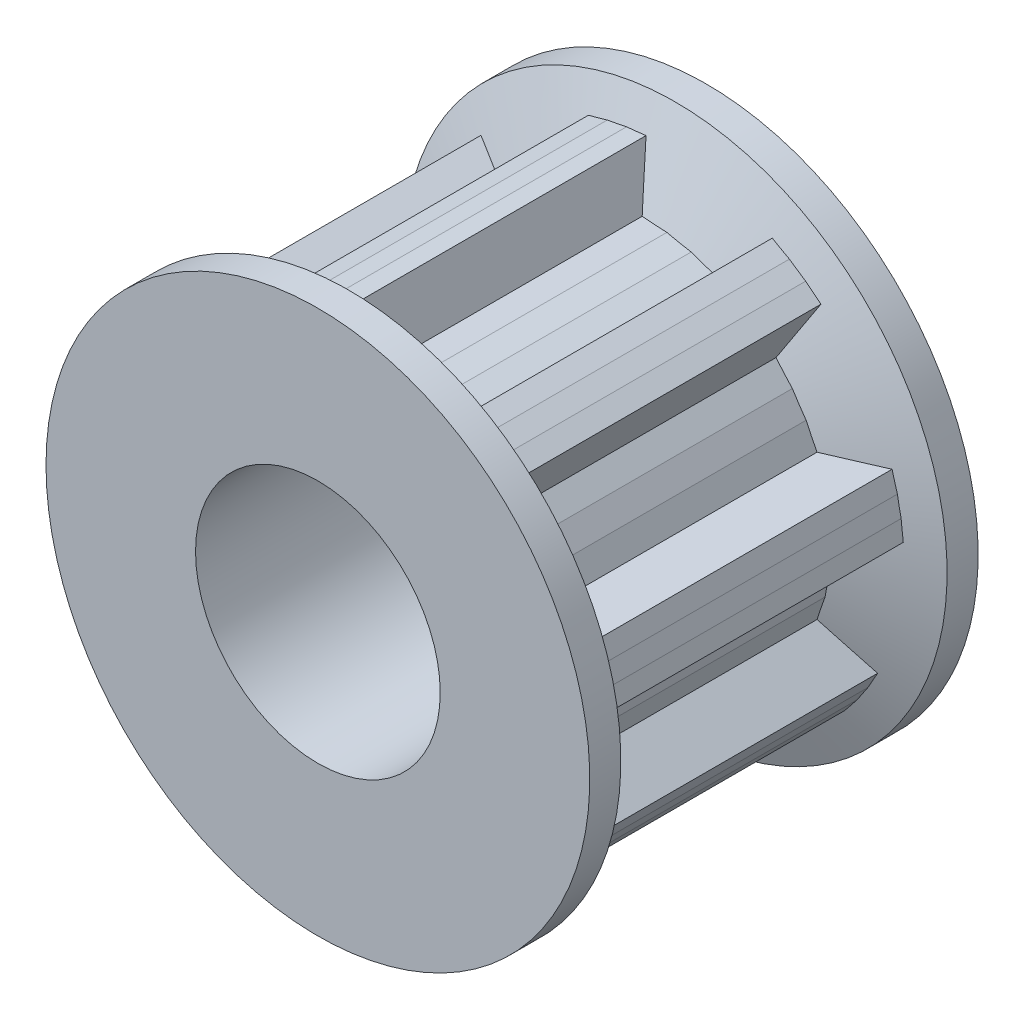
from build123d import *

# Parameters (mm, degrees)
SKETCH2_R           = 3.15
BOSS_EXTRUDE1_DEPTH = 10


with BuildPart() as part:
    # Sketch2 → Boss-Extrude1 (new body)
    with BuildSketch(Plane.XY):
        Polygon((4.873707771, 0), (4.832012177, -0.636146486), (4.707640171, -1.261407971), (4.502718925, -1.865087032), (5.52904892, -2.817190886), (5.281517029, -3.257688046), (4.998967171, -3.676585913), (4.683272839, -4.071106911), (3.44623208, -3.44623208), (2.966924906, -3.866571903), (2.436853886, -4.2207551), (1.865087032, -4.502718925), (1.917572975, -5.901682854), (1.431063056, -6.038129807), (0.935064673, -6.134541988), (0.432866603, -6.190280914), (0, -4.873707771), (-0.636146486, -4.832012177), (-1.261407971, -4.707640171), (-1.865087032, -4.502718925), (-2.817190886, -5.52904892), (-3.257688046, -5.281517029), (-3.676585913, -4.998967171), (-4.071106911, -4.683272839), (-3.44623208, -3.44623208), (-3.866571903, -2.966924906), (-4.2207551, -2.436853886), (-4.502718925, -1.865087032), (-5.901682854, -1.917572975), (-6.038129807, -1.431063056), (-6.134541988, -0.935064673), (-6.190280914, -0.432866603), (-4.873707771, 0), (-4.832012177, 0.636146486), (-4.707640171, 1.261407971), (-4.502718925, 1.865087032), (-5.52904892, 2.817190886), (-5.281517029, 3.257688046), (-4.998967171, 3.676585913), (-4.683272839, 4.071106911), (-3.44623208, 3.44623208), (-2.966924906, 3.866571903), (-2.436853886, 4.2207551), (-1.865087032, 4.502718925), (-1.917572975, 5.901682854), (-1.431063056, 6.038129807), (-0.935064673, 6.134541988), (-0.432866603, 6.190280914), (0, 4.873707771), (0.636146486, 4.832012177), (1.261407971, 4.707640171), (1.865087032, 4.502718925), (2.817190886, 5.52904892), (3.257688046, 5.281517029), (3.676585913, 4.998967171), (4.071106911, 4.683272839), (3.44623208, 3.44623208), (3.866571903, 2.966924906), (4.2207551, 2.436853886), (4.502718925, 1.865087032), (5.901682854, 1.917572975), (6.038129807, 1.431063056), (6.134541988, 0.935064673), (6.190280914, 0.432866603), align=None)
        Circle(SKETCH2_R, mode=Mode.SUBTRACT)
    extrude(amount=BOSS_EXTRUDE1_DEPTH)

    # Sketch3 → Revolve1 (revolve)
    with BuildSketch(Plane(origin=(0, 0, 0), x_dir=(1, 0, 0), z_dir=(0, 1, 0))):
        Polygon((-4, 0), (-7, 0), (-7, -0.8), (-4, -2), align=None)
    revolve1 = revolve(axis=Axis((0, 0, 0), (0, 0, 1)))

    # Mirror1: Revolve1 across plane
    add(revolve1.mirror(Plane.XY.offset(5)))


solid = part.part
